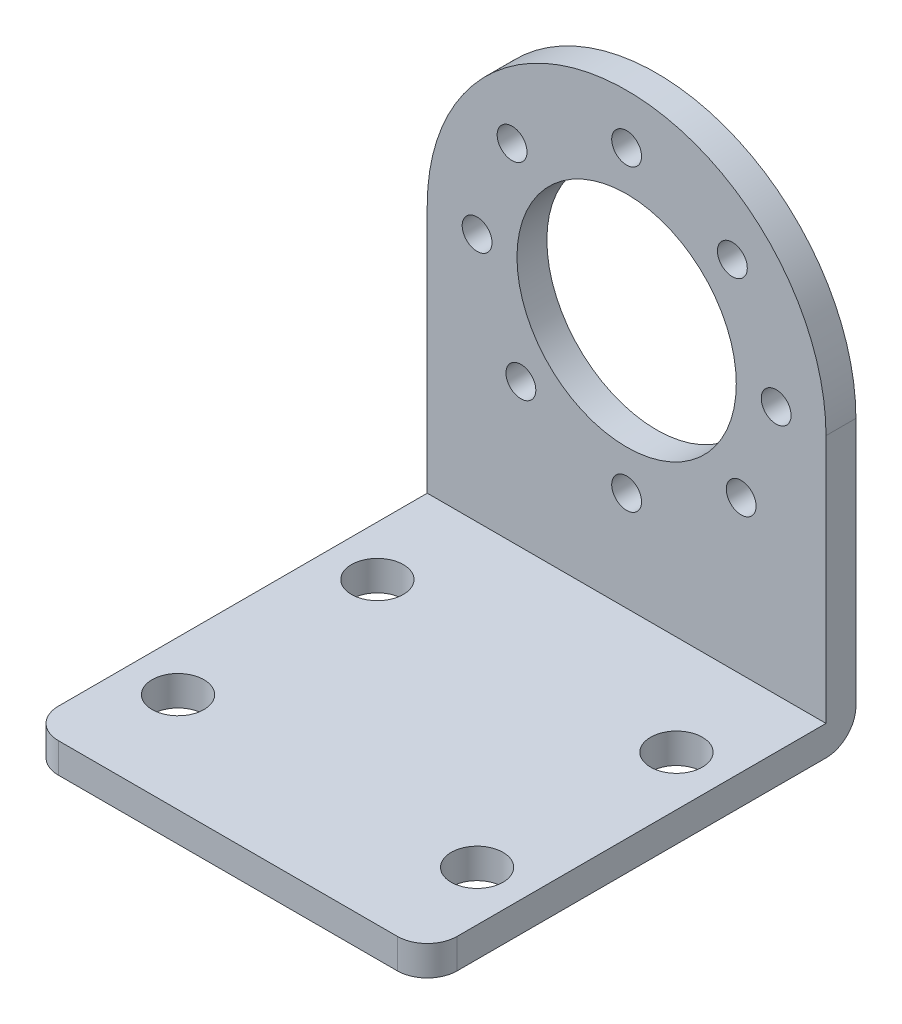
from build123d import *

# Parameters (mm, degrees)
EXTRUDE_1_DEPTH     = 3
SKETCH_2_W          = 40
SKETCH_2_H          = 3
EXTRUDE_2_DEPTH     = 40
SKETCH_3_R          = 2.6
CUT_EXTRUDE_1_DEPTH = 40
FILLET_1_R          = 3


with BuildPart() as part:
    # 草图1 → 凸台-拉伸1 (new body)
    with BuildSketch(Plane.XY):
        with BuildLine():
            Line((11, 0), (13.502586321, 0))
            ThreePointArc((13.502586321, 0), (13.915065254, 1.032067984), (14.925258409, 1.495547198))
            ThreePointArc((14.925258409, 1.495547198), (13.858192988, 5.740251485), (11.611262997, 9.496239867))
            ThreePointArc((11.611262997, 9.496239867), (9.547770351, 9.547770351), (9.496239867, 11.611262997))
            ThreePointArc((9.496239867, 11.611262997), (5.740251485, 13.858192988), (1.495547198, 14.925258409))
            ThreePointArc((1.495547198, 14.925258409), (0, 13.502586321), (-1.495547198, 14.925258409))
            ThreePointArc((-1.495547198, 14.925258409), (-6.339273926, 13.594616806), (-10.472092058, 10.739426797))
            ThreePointArc((-10.472092058, 10.739426797), (-10.118173432, 10.240571276), (-9.993252967, 9.641814145))
            ThreePointArc((-9.993252967, 9.641814145), (-10.824149511, 8.300917939), (-12.394730475, 8.448115556))
            ThreePointArc((-12.394730475, 8.448115556), (-14.095389312, 5.13030215), (-14.925258409, 1.495547198))
            ThreePointArc((-14.925258409, 1.495547198), (-13.915065254, 1.032067984), (-13.502586321, 0))
            Line((-13.502586321, 0), (-11, 0))
            ThreePointArc((-11, 0), (0, 11), (11, 0))
        make_face()
        with BuildLine():
            ThreePointArc((14.925258409, -1.495547198), (13.915065254, -1.032067984), (13.502586321, 0))
            Line((13.502586321, 0), (11, 0))
            ThreePointArc((11, 0), (0, -11), (-11, 0))
            Line((-11, 0), (-13.502586321, 0))
            ThreePointArc((-13.502586321, 0), (-13.915065254, -1.032067984), (-14.925258409, -1.495547198))
            ThreePointArc((-14.925258409, -1.495547198), (-13.858192988, -5.740251485), (-11.611262997, -9.496239867))
            ThreePointArc((-11.611262997, -9.496239867), (-9.99920803, -9.237908679), (-9.109188038, -10.606601718))
            ThreePointArc((-9.109188038, -10.606601718), (-9.209297393, -11.144921652), (-9.496239867, -11.611262997))
            ThreePointArc((-9.496239867, -11.611262997), (-5.740251485, -13.858192988), (-1.495547198, -14.925258409))
            ThreePointArc((-1.495547198, -14.925258409), (0, -13.502586321), (1.495547198, -14.925258409))
            ThreePointArc((1.495547198, -14.925258409), (6.339273926, -13.594616806), (10.472092058, -10.739426797))
            ThreePointArc((10.472092058, -10.739426797), (10.343581219, -8.679295186), (12.394730475, -8.448115556))
            ThreePointArc((12.394730475, -8.448115556), (14.095389312, -5.13030215), (14.925258409, -1.495547198))
        make_face()
        with BuildLine():
            ThreePointArc((14.925258409, 1.495547198), (16.032067984, 1.084934746), (16.497413679, 0))
            Line((16.497413679, 0), (20, 0))
            ThreePointArc((20, 0), (0, 20), (-20, 0))
            Line((-20, 0), (-16.497413679, 0))
            ThreePointArc((-16.497413679, 0), (-16.032067984, 1.084934746), (-14.925258409, 1.495547198))
            ThreePointArc((-14.925258409, 1.495547198), (-14.095389312, 5.13030215), (-12.394730475, 8.448115556))
            ThreePointArc((-12.394730475, 8.448115556), (-12.637752075, 10.604333105), (-10.472092058, 10.739426797))
            ThreePointArc((-10.472092058, 10.739426797), (-6.339273926, 13.594616806), (-1.495547198, 14.925258409))
            ThreePointArc((-1.495547198, 14.925258409), (-0.037382446, 16.496946986), (1.497413679, 15))
            ThreePointArc((1.497413679, 15), (1.496946986, 14.962617554), (1.495547198, 14.925258409))
            ThreePointArc((1.495547198, 14.925258409), (5.740251485, 13.858192988), (9.496239867, 11.611262997))
            ThreePointArc((9.496239867, 11.611262997), (11.144921652, 12.003906043), (12.104015397, 10.606601718))
            ThreePointArc((12.104015397, 10.606601718), (11.975294757, 9.99920803), (11.611262997, 9.496239867))
            ThreePointArc((11.611262997, 9.496239867), (13.858192988, 5.740251485), (14.925258409, 1.495547198))
        make_face()
        with BuildLine():
            Line((20, 0), (16.497413679, 0))
            ThreePointArc((16.497413679, 0), (16.032067984, -1.084934746), (14.925258409, -1.495547198))
            ThreePointArc((14.925258409, -1.495547198), (14.095389312, -5.13030215), (12.394730475, -8.448115556))
            ThreePointArc((12.394730475, -8.448115556), (12.831562853, -8.97529701), (12.988080326, -9.641814145))
            ThreePointArc((12.988080326, -9.641814145), (12.089423778, -11.01430736), (10.472092058, -10.739426797))
            ThreePointArc((10.472092058, -10.739426797), (6.339273926, -13.594616806), (1.495547198, -14.925258409))
            ThreePointArc((1.495547198, -14.925258409), (1.496946986, -14.962617554), (1.497413679, -15))
            ThreePointArc((1.497413679, -15), (-0.037382446, -16.496946986), (-1.495547198, -14.925258409))
            ThreePointArc((-1.495547198, -14.925258409), (-5.740251485, -13.858192988), (-9.496239867, -11.611262997))
            ThreePointArc((-9.496239867, -11.611262997), (-11.665433085, -11.665433085), (-11.611262997, -9.496239867))
            ThreePointArc((-11.611262997, -9.496239867), (-13.858192988, -5.740251485), (-14.925258409, -1.495547198))
            ThreePointArc((-14.925258409, -1.495547198), (-16.032067984, -1.084934746), (-16.497413679, 0))
            Line((-16.497413679, 0), (-20, 0))
            ThreePointArc((-20, 0), (0, -20), (20, 0))
        make_face()
        with BuildLine():
            Line((20, -28), (20, 0))
            ThreePointArc((20, 0), (0, -20), (-20, 0))
            Line((-20, 0), (-20, -28))
            Line((-20, -28), (20, -28))
        make_face()
    extrude(amount=EXTRUDE_1_DEPTH)

    # 草图2 → 凸台-拉伸2 (add)
    with BuildSketch(Plane.XY.offset(3)):
        with Locations((0, -26.5)):
            Rectangle(SKETCH_2_W, SKETCH_2_H)
    extrude(amount=EXTRUDE_2_DEPTH)

    # 草图3 → 切除-拉伸1 (cut)
    with BuildSketch(Plane(origin=(0, -25, 0), x_dir=(1, 0, 0), z_dir=(0, 1, 0))):
        with Locations(Location((-15, -13, 0), (0, 0, 270))):
            Circle(SKETCH_3_R)
        with Locations(Location((-15, -33, 0), (0, 0, 270))):
            Circle(SKETCH_3_R)
        with Locations(Location((15, -33, 0), (0, 0, 270))):
            Circle(SKETCH_3_R)
        with Locations(Location((15, -13, 0), (0, 0, 270))):
            Circle(SKETCH_3_R)
    extrude(amount=-CUT_EXTRUDE_1_DEPTH, mode=Mode.SUBTRACT)

    # 圆角1
    fillet_1_edges = [part.edges().sort_by_distance(p)[0] for p in [
        (0, -28, 0),
        (-20, -26.5, 43),
        (20, -26.5, 43),
    ]]
    fillet(fillet_1_edges, radius=FILLET_1_R)


solid = part.part
